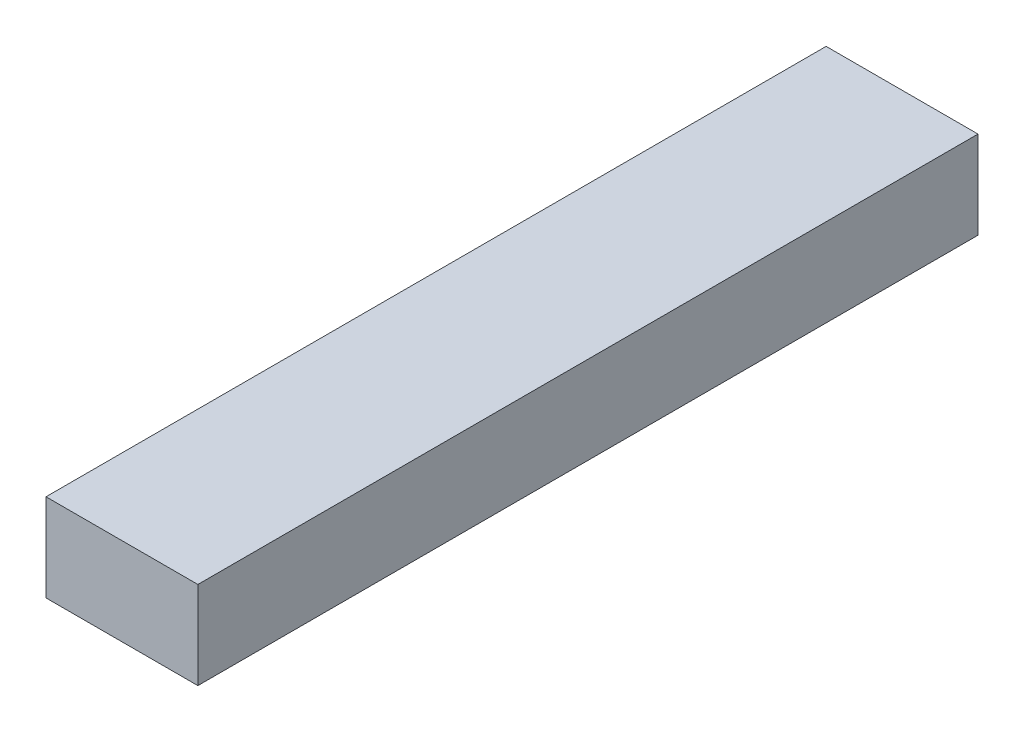
from build123d import *

# Parameters (mm, degrees)
BASE_SKETCH_W             = 5.2
BASE_SKETCH_H             = 26.71
BASE_SKETCH_EXTRUDE_DEPTH = 3


with BuildPart() as part:
    # Base Sketch → Base Sketch Extrude (new body)
    with BuildSketch(Plane(origin=(0, 15, 0), x_dir=(1, 0, 0), z_dir=(0, 1, 0))):
        with Locations((18.07, 66.355)):
            Rectangle(BASE_SKETCH_W, BASE_SKETCH_H)
    extrude(amount=BASE_SKETCH_EXTRUDE_DEPTH)


solid = part.part
